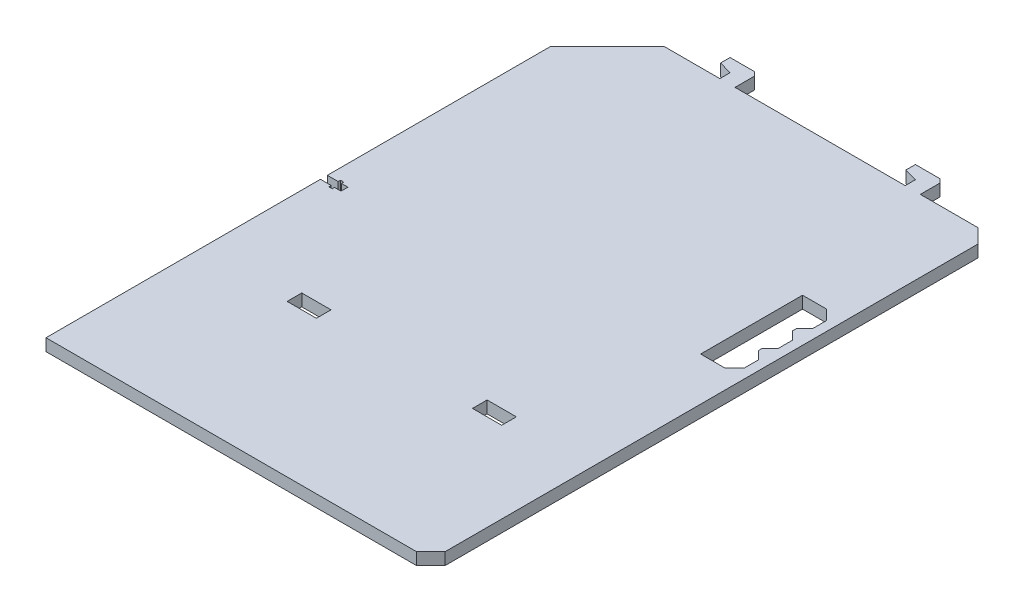
from build123d import *

# Parameters (mm, degrees)
SKETCH1_W           = 15.5
SKETCH1_H           = 7.75
BOSS_EXTRUDE1_DEPTH = 6.4


with BuildPart() as part:
    # Sketch1 → Boss-Extrude1 (new body)
    with BuildSketch(Plane(origin=(0, 0, 0), x_dir=(1, 0, 0), z_dir=(0, 1, 0))):
        Polygon((136.176, 177.3), (166.73, 177.3), (174.23, 169.8), (174.23, -112.7), (166.73, -120.2), (-29.725, -120.2), (-29.725, 25.249320413), (-24.025, 25.249320413), (-24.025, 24.000679587), (-22.225, 24.000679587), (-22.225, 25.249320413), (-18.825, 25.249320413), (-18.825, 28.900679587), (-22.225, 28.900679587), (-22.225, 30.150679587), (-24.025, 30.150679587), (-24.025, 28.900679587), (-29.725, 28.900679587), (-29.725, 147.3), (0.275, 177.3), (29.906, 177.3), (29.906, 182.7), (22.906, 184.689990555), (22.941578202, 189.687449255), (35.946, 189.687449255), (37.946, 187.687449255), (37.946, 177.3), (128.136, 177.3), (128.136, 182.7), (121.136, 184.689990555), (121.171578202, 189.687449255), (134.176, 189.687449255), (136.176, 187.687449255), align=None)
        with Locations((123.48, -35.75)):
            Rectangle(SKETCH1_W, SKETCH1_H, mode=Mode.SUBTRACT)
        with Locations((25.25, -35.75)):
            Rectangle(SKETCH1_W, SKETCH1_H, mode=Mode.SUBTRACT)
        Polygon((164.957922061, 82.8), (164.957922061, 80.8), (169.23, 76.527922061), (169.23, 69.072077939), (164.957922061, 64.8), (164.957922061, 62.8), (169.23, 58.527922061), (169.23, 51.072077939), (163.957922061, 45.8), (151.23, 45.8), (151.23, 99.8), (163.957922061, 99.8), (169.23, 94.527922061), (169.23, 87.072077939), align=None, mode=Mode.SUBTRACT)
    extrude(amount=BOSS_EXTRUDE1_DEPTH)


solid = part.part
